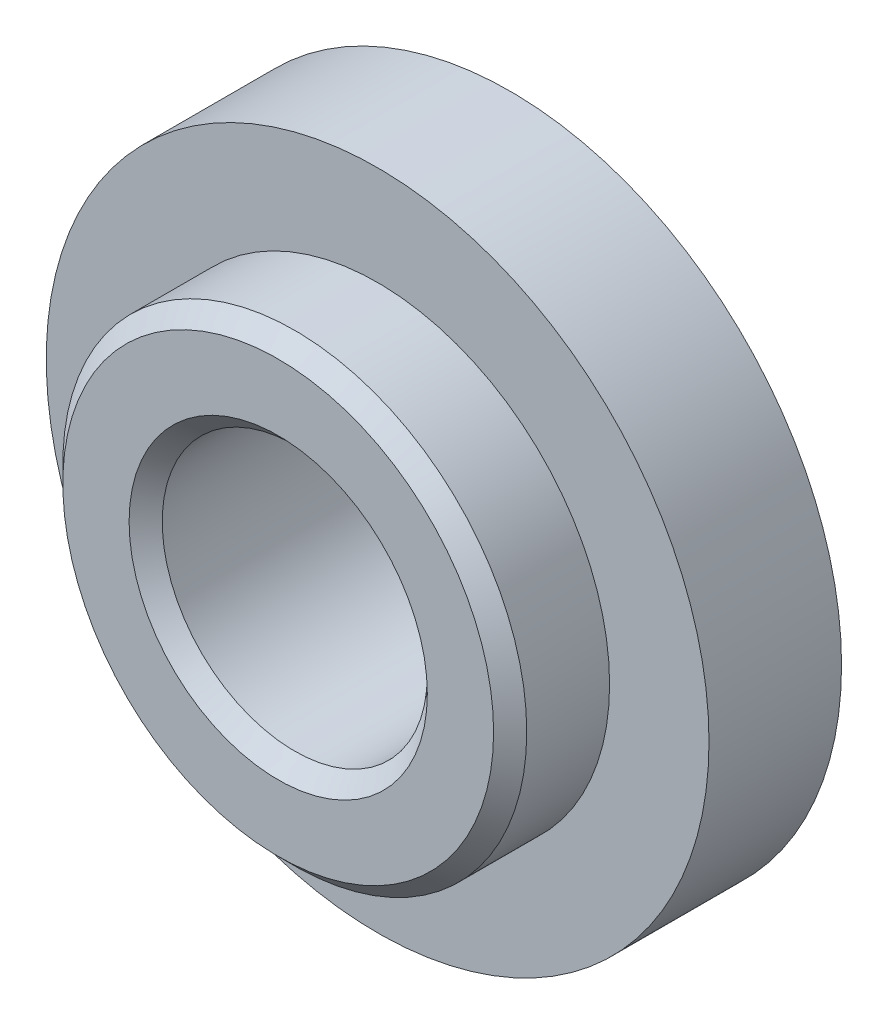
from build123d import *

# Parameters (mm, degrees)
ESQUISSE1_R          = 10
ESQUISSE1_R_2        = 4
BASE_EXTRUSION_DEPTH = 4
ESQUISSE2_R          = 7
ESQUISSE2_R_2        = 4
BOSS_EXTRU_1_DEPTH   = 3
CHANFREIN3_SIZE      = 0.5


with BuildPart() as part:
    # Esquisse1 → Base-Extrusion (new body)
    with BuildSketch(Plane.XY):
        Circle(ESQUISSE1_R)
        Circle(ESQUISSE1_R_2, mode=Mode.SUBTRACT)
    extrude(amount=BASE_EXTRUSION_DEPTH)

    # Esquisse2 → Boss.-Extru.1 (add)
    with BuildSketch(Plane.XY.offset(4)):
        Circle(ESQUISSE2_R)
        Circle(ESQUISSE2_R_2, mode=Mode.SUBTRACT)
    extrude(amount=BOSS_EXTRU_1_DEPTH)

    # Chanfrein3
    chanfrein3_edges = [part.edges().sort_by_distance(p)[0] for p in [
        (-7, 0, 7),
        (-4, 0, 7),
        (-4, 0, 0),
    ]]
    chamfer(chanfrein3_edges, length=CHANFREIN3_SIZE)


solid = part.part
